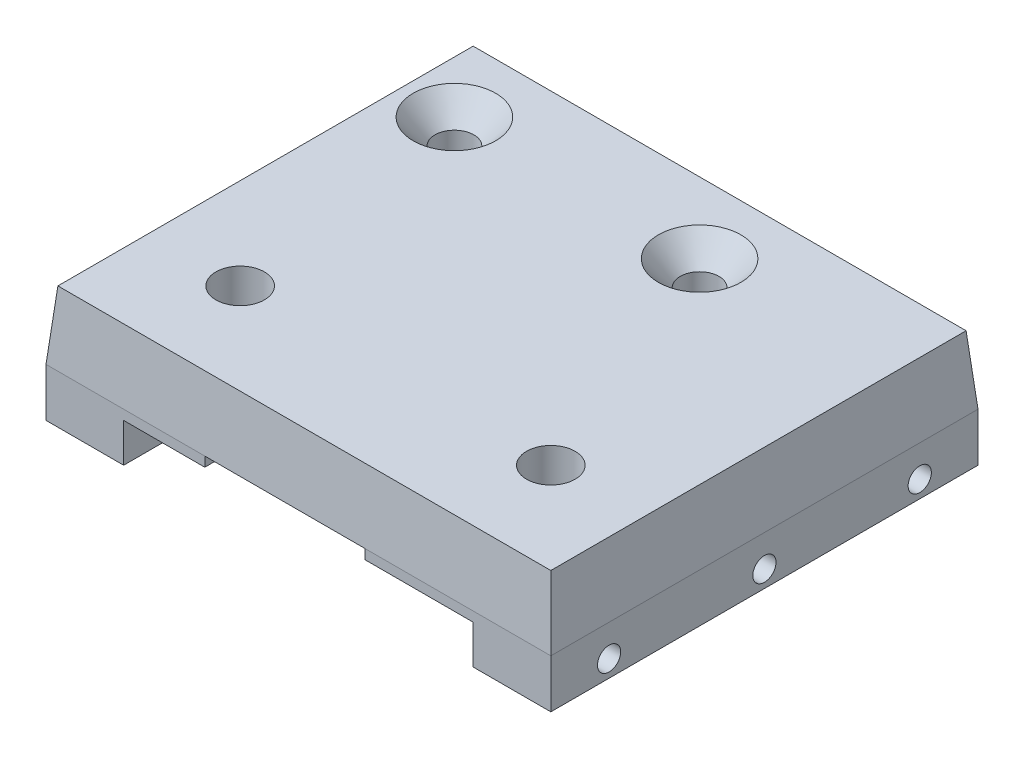
from build123d import *

# Parameters (mm, degrees)
SKETCH1_W                             = 82.55
SKETCH1_H                             = 69.85
BOSS_EXTRUDE1_DEPTH                   = 7.9375
SKETCH2_W                             = 82.55
SKETCH2_H                             = 69.85
BOSS_EXTRUDE2_DEPTH                   = 3.175
F_3_8_16_TAPPED_HOLE1_D               = 7.9375
F_3_8_16_TAPPED_HOLE1_DEPTH           = 9.525
F_3_8_16_TAPPED_HOLE1_TIP             = 2.384665582
DRAFT1_ANGLE                          = 5
SKETCH3_W                             = 12.7
SKETCH3_H                             = 69.85
BOSS_EXTRUDE3_DEPTH                   = 7.9375
SKETCH4_W                             = 13.267261336
SKETCH4_H                             = 69.85
SKETCH4_W_2                           = 17.684109612
WEAR_PADS_DEPTH                       = 1.5875
F_10_24_TAPPED_HOLE1_D                = 3.7973
F_10_24_TAPPED_HOLE1_DEPTH            = 12.7
F_1_4_0_25_DIAMETER_HOLE1_D           = 6.35
F_1_4_0_25_DIAMETER_HOLE1_DEPTH       = 8.89
F_1_4_0_25_DIAMETER_HOLE1_CSINK_D     = 13.4874
F_1_4_0_25_DIAMETER_HOLE1_CSINK_ANGLE = 82
F_1_4_0_25_DIAMETER_HOLE1_TIP         = 1.907732465
F_1_4_20_TAPPED_HOLE1_D               = 5.1054
F_1_4_20_TAPPED_HOLE1_DEPTH           = 11.43
F_1_4_20_TAPPED_HOLE1_TIP             = 1.533816902
F_1_4_20_TAPPED_HOLE2_D               = 5.1054
F_1_4_20_TAPPED_HOLE2_DEPTH           = 11.43
F_1_4_20_TAPPED_HOLE2_TIP             = 1.533816902


with BuildPart() as part:
    # Sketch1 → Boss-Extrude1 (new body)
    with BuildSketch(Plane(origin=(0, 0, 0), x_dir=(1, 0, 0), z_dir=(0, 1, 0))):
        Rectangle(SKETCH1_W, SKETCH1_H)
    extrude(amount=BOSS_EXTRUDE1_DEPTH)

    # Sketch2 → Boss-Extrude2 (add)
    with BuildSketch(Plane(origin=(0, 7.9375, 0), x_dir=(1, 0, 0), z_dir=(0, 1, 0))):
        Rectangle(SKETCH2_W, SKETCH2_H)
    extrude(amount=BOSS_EXTRUDE2_DEPTH)

    # 3/8-16 Tapped Hole1
    with Locations(Plane(origin=(0, 11.1125, 0), x_dir=(1, 0, 0), z_dir=(0, 1, 0))):
        with Locations((-25.4, -19.05), (25.4, -19.05)):
            Hole(F_3_8_16_TAPPED_HOLE1_D / 2, depth=F_3_8_16_TAPPED_HOLE1_DEPTH)
            with Locations((0, 0, -(F_3_8_16_TAPPED_HOLE1_DEPTH + F_3_8_16_TAPPED_HOLE1_TIP / 2))):  # 118° drill point
                Cone(0, F_3_8_16_TAPPED_HOLE1_D / 2, F_3_8_16_TAPPED_HOLE1_TIP, mode=Mode.SUBTRACT)

    # Draft1
    draft1_faces = [part.faces().sort_by_distance(p)[0] for p in [
        (0, 5.55625, -34.925),
        (-41.275, 5.55625, 0),
        (0, 5.55625, 34.925),
        (41.275, 5.55625, 0),
    ]]
    draft(draft1_faces, Plane.ZX, DRAFT1_ANGLE)

    # Sketch3 → Boss-Extrude3 (add)
    with BuildSketch(Plane.XZ):
        with Locations((34.925, 0)):
            Rectangle(SKETCH3_W, SKETCH3_H)
        with Locations((-34.925, 0)):
            Rectangle(SKETCH3_W, SKETCH3_H)
    extrude(amount=BOSS_EXTRUDE3_DEPTH)

    # Sketch4 → Wear Pads (add)
    with BuildSketch(Plane.XZ):
        with Locations((-21.941369332, 0)):
            Rectangle(SKETCH4_W, SKETCH4_H)
        with Locations((19.732945194, 0)):
            Rectangle(SKETCH4_W_2, SKETCH4_H)
    extrude(amount=WEAR_PADS_DEPTH)

    # #10-24 Tapped Hole1
    with Locations(Plane(origin=(41.275, 0, 0), x_dir=(0, 0, -1), z_dir=(1, 0, 0))):
        with Locations((-25.4, -5.151627132), (25.4, -5.151627132), (0, -5.151627132)):
            Hole(F_10_24_TAPPED_HOLE1_D / 2, depth=F_10_24_TAPPED_HOLE1_DEPTH)

    # 1/4 (0.25) Diameter Hole1
    with Locations(Plane(origin=(0, 11.1125, 0), x_dir=(1, 0, 0), z_dir=(0, 1, 0))):
        with Locations((-31.795373704, 22.378883405), (8.300402943, 22.378883405)):
            CounterSinkHole(F_1_4_0_25_DIAMETER_HOLE1_D / 2, F_1_4_0_25_DIAMETER_HOLE1_CSINK_D / 2, depth=F_1_4_0_25_DIAMETER_HOLE1_DEPTH, counter_sink_angle=F_1_4_0_25_DIAMETER_HOLE1_CSINK_ANGLE)
            with Locations((0, 0, -(F_1_4_0_25_DIAMETER_HOLE1_DEPTH + F_1_4_0_25_DIAMETER_HOLE1_TIP / 2))):  # 118° drill point
                Cone(0, F_1_4_0_25_DIAMETER_HOLE1_D / 2, F_1_4_0_25_DIAMETER_HOLE1_TIP, mode=Mode.SUBTRACT)

    # 1/4-20 Tapped Hole1
    with Locations(Plane(origin=(0, -7.9375, 0), x_dir=(-1, 0, 0), z_dir=(0, -1, 0))):
        with Locations((-33.3375, 15.875), (-33.3375, -15.875)):
            Hole(F_1_4_20_TAPPED_HOLE1_D / 2, depth=F_1_4_20_TAPPED_HOLE1_DEPTH)
            with Locations((0, 0, -(F_1_4_20_TAPPED_HOLE1_DEPTH + F_1_4_20_TAPPED_HOLE1_TIP / 2))):  # 118° drill point
                Cone(0, F_1_4_20_TAPPED_HOLE1_D / 2, F_1_4_20_TAPPED_HOLE1_TIP, mode=Mode.SUBTRACT)

    # 1/4-20 Tapped Hole2
    with Locations(Plane(origin=(0, -7.9375, 0), x_dir=(-1, 0, 0), z_dir=(0, -1, 0))):
        with Locations((33.3375, -15.875), (33.3375, 15.875)):
            Hole(F_1_4_20_TAPPED_HOLE2_D / 2, depth=F_1_4_20_TAPPED_HOLE2_DEPTH)
            with Locations((0, 0, -(F_1_4_20_TAPPED_HOLE2_DEPTH + F_1_4_20_TAPPED_HOLE2_TIP / 2))):  # 118° drill point
                Cone(0, F_1_4_20_TAPPED_HOLE2_D / 2, F_1_4_20_TAPPED_HOLE2_TIP, mode=Mode.SUBTRACT)


solid = part.part
